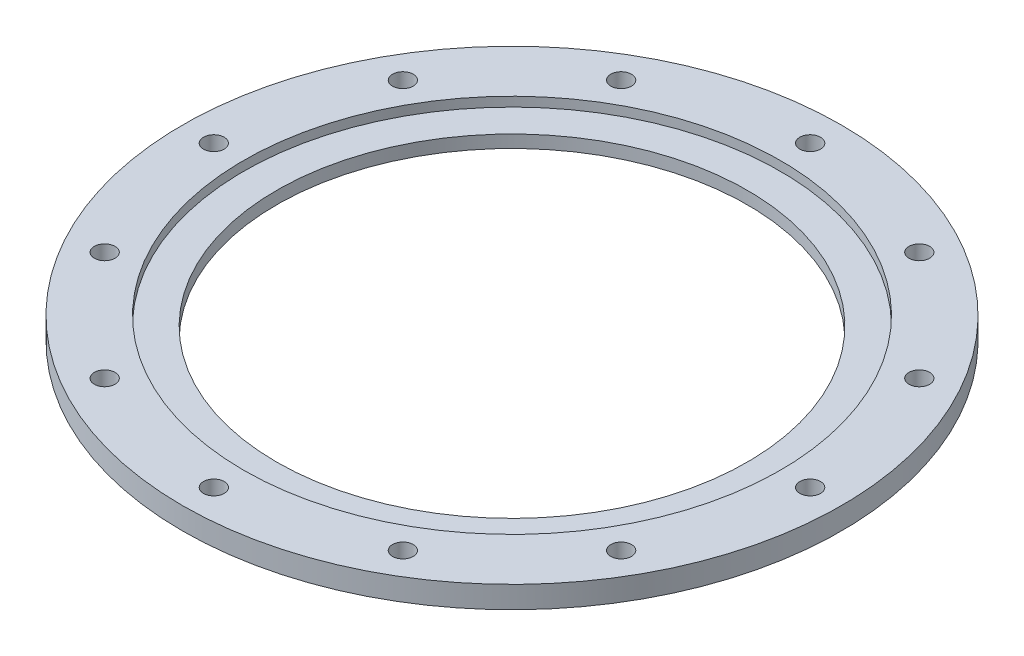
from build123d import *

# Parameters (mm, degrees)
SKETCH1_R           = 52.5
SKETCH1_R_2         = 37.5
BOSS_EXTRUDE1_DEPTH = 2
SKETCH2_R           = 52.5
SKETCH2_R_2         = 42.75
BOSS_EXTRUDE2_DEPTH = 1.5
SKETCH3_R           = 1.65
CUT_EXTRUDE1_DEPTH  = 75.328662036
CIRPATTERN1_COUNT   = 12


with BuildPart() as part:
    # Sketch1 → Boss-Extrude1 (new body)
    with BuildSketch(Plane(origin=(0, 0, 0), x_dir=(1, 0, 0), z_dir=(0, 1, 0))):
        with Locations(Location((0, 0, 0), (0, 0, 270))):
            Circle(SKETCH1_R)
        with Locations(Location((0, 0, 0), (0, 0, 270))):
            Circle(SKETCH1_R_2, mode=Mode.SUBTRACT)
    extrude(amount=BOSS_EXTRUDE1_DEPTH)

    # Sketch2 → Boss-Extrude2 (add)
    with BuildSketch(Plane(origin=(0, 2, 0), x_dir=(1, 0, 0), z_dir=(0, 1, 0))):
        with Locations(Location((0, 0, 0), (0, 0, 270))):
            Circle(SKETCH2_R)
        with Locations(Location((0, 0, 0), (0, 0, 270))):
            Circle(SKETCH2_R_2, mode=Mode.SUBTRACT)
    extrude(amount=BOSS_EXTRUDE2_DEPTH)

    # Sketch3 → Cut-Extrude1 (cut, through all)
    with BuildSketch(Plane.XZ):
        with Locations(Location((47.5, 0, 0), (0, 0, 270))):
            Circle(SKETCH3_R)
    cut_extrude1 = extrude(amount=-CUT_EXTRUDE1_DEPTH, mode=Mode.SUBTRACT)

    # CirPattern1: Cut-Extrude1 ×12 about axis
    cirpattern1_axis = Axis((0, 0, 0), (0, 1, 0))
    for i in range(1, CIRPATTERN1_COUNT):
        add(cut_extrude1.rotate(cirpattern1_axis, i * 360 / CIRPATTERN1_COUNT), mode=Mode.SUBTRACT)


solid = part.part
